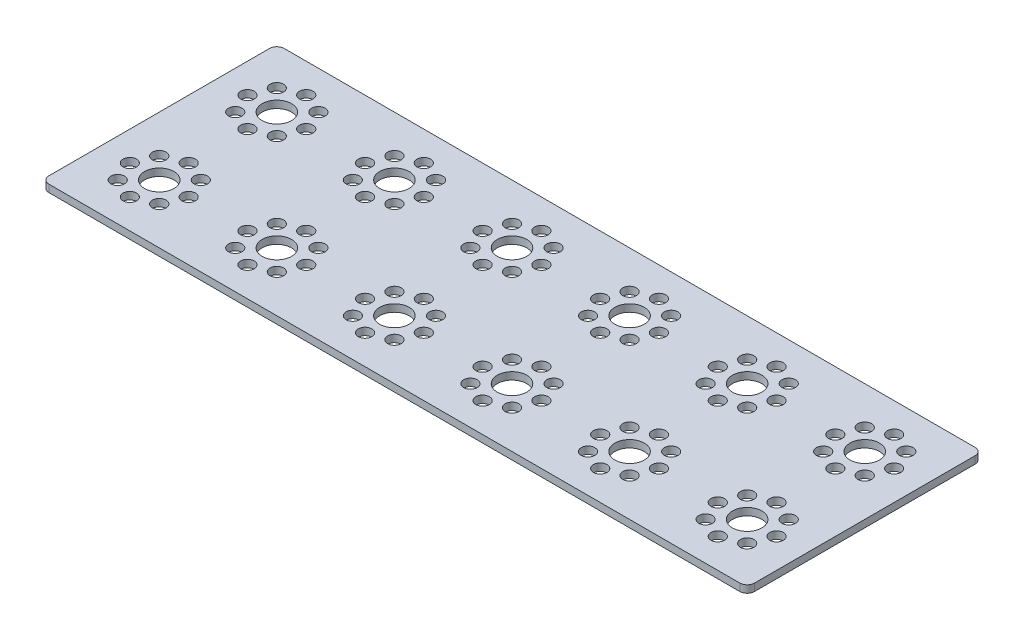
from build123d import *

# Parameters (mm, degrees)
SKETCH1_W            = 192
SKETCH1_H            = 64
EXTRUDE1_DEPTH       = 2
SKETCH2_R            = 4
SKETCH2_R_2          = 1.85
CUT_EXTRUDE1_DEPTH   = 102.212647431
LPATTERN1_COUNT      = 6
LPATTERN1_PITCH      = 32
LPATTERN1_COUNT_DIR2 = 2
LPATTERN1_PITCH_DIR2 = 32
FILLET1_R            = 2


with BuildPart() as part:
    # Sketch1 → Extrude1 (new body)
    with BuildSketch(Plane(origin=(0, 0, 0), x_dir=(1, 0, 0), z_dir=(0, 1, 0))):
        Rectangle(SKETCH1_W, SKETCH1_H)
    extrude(amount=EXTRUDE1_DEPTH)

    # Sketch2 → Cut-Extrude1 (cut, through all)
    with BuildSketch(Plane(origin=(0, 2, 0), x_dir=(1, 0, 0), z_dir=(0, 1, 0))):
        with Locations(Location((-80, 16, 0), (0, 0, 270))):
            Circle(SKETCH2_R)
        with Locations(Location((-80, 8, 0), (0, 0, 270))):
            Circle(SKETCH2_R_2)
        with Locations(Location((-80, 24, 0), (0, 0, 270))):
            Circle(SKETCH2_R_2)
        with Locations(Location((-88, 16, 0), (0, 0, 270))):
            Circle(SKETCH2_R_2)
        with Locations(Location((-72, 16, 0), (0, 0, 270))):
            Circle(SKETCH2_R_2)
        with Locations(Location((-74.343145751, 21.656854249, 0), (0, 0, 270))):
            Circle(SKETCH2_R_2)
        with Locations(Location((-85.656854249, 21.656854249, 0), (0, 0, 270))):
            Circle(SKETCH2_R_2)
        with Locations(Location((-74.343145751, 10.343145751, 0), (0, 0, 270))):
            Circle(SKETCH2_R_2)
        with Locations(Location((-85.656854249, 10.343145751, 0), (0, 0, 270))):
            Circle(SKETCH2_R_2)
    cut_extrude1 = extrude(amount=-CUT_EXTRUDE1_DEPTH, mode=Mode.SUBTRACT)

    # LPattern1: Cut-Extrude1 6 × 2
    with Locations(*[(i * LPATTERN1_PITCH, 0, j * LPATTERN1_PITCH_DIR2) for i in range(LPATTERN1_COUNT) for j in range(LPATTERN1_COUNT_DIR2) if (i, j) != (0, 0)]):
        add(cut_extrude1, mode=Mode.SUBTRACT)

    # Fillet1
    fillet1_edges = [part.edges().sort_by_distance(p)[0] for p in [
        (-96, 1, -32),
        (96, 1, -32),
        (96, 1, 32),
        (-96, 1, 32),
    ]]
    fillet(fillet1_edges, radius=FILLET1_R)


solid = part.part
